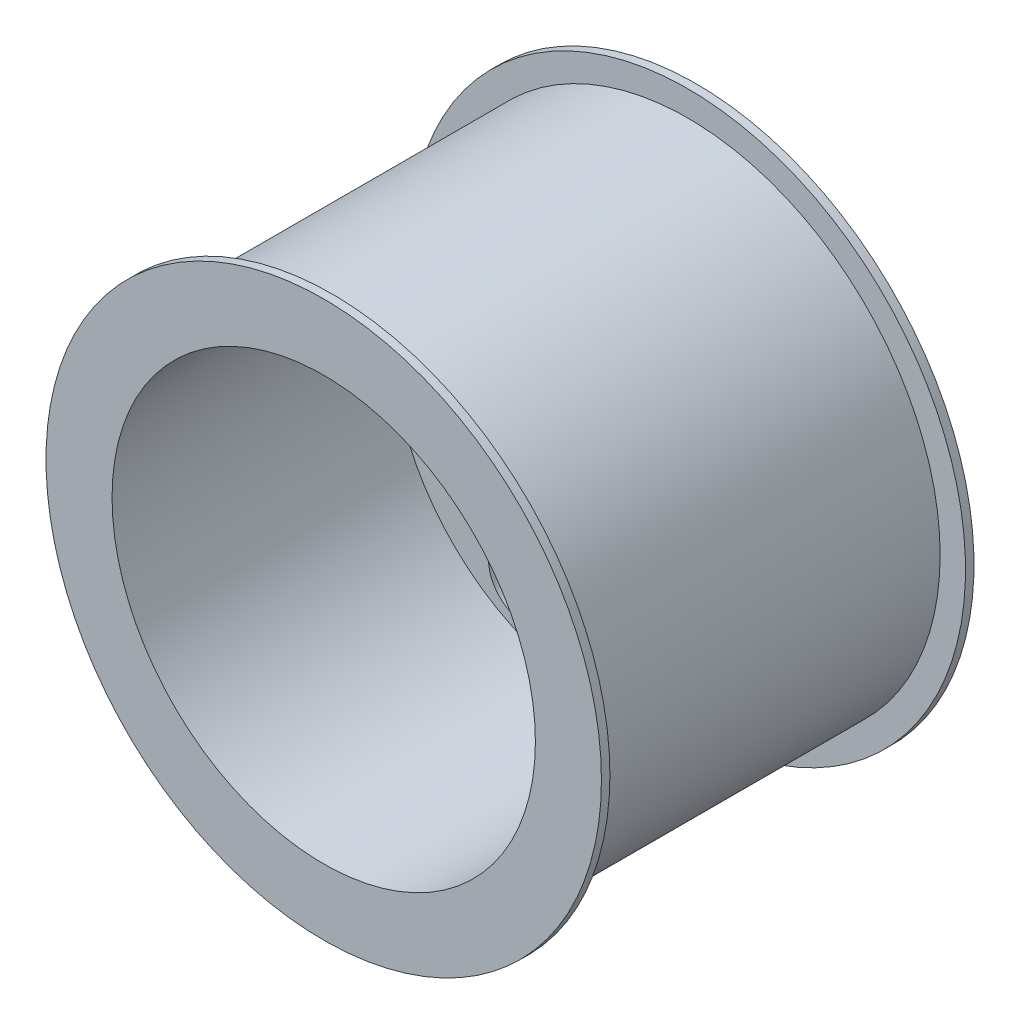
from build123d import *

# Parameters (mm, degrees)
SKETCH1_R           = 32.8
SKETCH1_R_2         = 25
BOSS_EXTRUDE1_DEPTH = 1
BOSS_EXTRUDE2_START = -33
SKETCH2_R           = 29.8
SKETCH2_R_2         = 25
BOSS_EXTRUDE2_DEPTH = 33
BOSS_EXTRUDE3_START = 10
SKETCH3_R           = 29.8
BOSS_EXTRUDE3_DEPTH = 10
BOSS_EXTRUDE4_START = 1
SKETCH4_R           = 32.8
BOSS_EXTRUDE4_DEPTH = 1
SKETCH5_R           = 2.95
CUT_EXTRUDE1_DEPTH  = 64.934966959
SKETCH6_R           = 4.45
CUT_EXTRUDE2_DEPTH  = 64.934966959
SKETCH7_R           = 3
CUT_EXTRUDE3_DEPTH  = 9.4
SKETCH8_R           = 2.5
CUT_EXTRUDE4_DEPTH  = 21


with BuildPart() as part:
    # Sketch1 → Boss-Extrude1 (new body)
    with BuildSketch(Plane.XY):
        Circle(SKETCH1_R)
        Circle(SKETCH1_R_2, mode=Mode.SUBTRACT)
    extrude(amount=BOSS_EXTRUDE1_DEPTH)

    # Sketch2 → Boss-Extrude2 (add)
    with BuildSketch(Plane.XY.offset(1).offset(BOSS_EXTRUDE2_START)):
        Circle(SKETCH2_R)
        Circle(SKETCH2_R_2, mode=Mode.SUBTRACT)
    extrude(amount=BOSS_EXTRUDE2_DEPTH)

    # Sketch3 → Boss-Extrude3 (add)
    with BuildSketch(Plane(origin=(0, 0, -32), x_dir=(-1, 0, 0), z_dir=(0, 0, -1)).offset(BOSS_EXTRUDE3_START)):
        with Locations(Location((0, 0, 0), (0, 0, 180))):
            Circle(SKETCH3_R)
    extrude(amount=-BOSS_EXTRUDE3_DEPTH)

    # Sketch4 → Boss-Extrude4 (add)
    with BuildSketch(Plane(origin=(0, 0, -42), x_dir=(-1, 0, 0), z_dir=(0, 0, -1)).offset(BOSS_EXTRUDE4_START)):
        with Locations(Location((0, 0, 0), (0, 0, 180))):
            Circle(SKETCH4_R)
    extrude(amount=-BOSS_EXTRUDE4_DEPTH)

    # Sketch5 → Cut-Extrude1 (cut, through all)
    with BuildSketch(Plane(origin=(0, 0, -43), x_dir=(-1, 0, 0), z_dir=(0, 0, -1))):
        Circle(SKETCH5_R)
    extrude(amount=-CUT_EXTRUDE1_DEPTH, mode=Mode.SUBTRACT)

    # Sketch6 → Cut-Extrude2 (cut, through all)
    with BuildSketch(Plane(origin=(0, 0, -43), x_dir=(-1, 0, 0), z_dir=(0, 0, -1))):
        with Locations((10.300490658, 16.439583091)):
            Circle(SKETCH6_R)
        with Locations((19.387341913, -0.700695036)):
            Circle(SKETCH6_R)
        with Locations((9.086851255, -17.140278127)):
            Circle(SKETCH6_R)
        with Locations((-10.300490658, -16.439583091)):
            Circle(SKETCH6_R)
        with Locations((-19.387341913, 0.700695036)):
            Circle(SKETCH6_R)
        with Locations((-9.086851255, 17.140278127)):
            Circle(SKETCH6_R)
    extrude(amount=-CUT_EXTRUDE2_DEPTH, mode=Mode.SUBTRACT)

    # Sketch7 → Cut-Extrude3 (cut)
    with BuildSketch(Plane(origin=(-25.807557033, 14.9, 0), x_dir=(0, 0, 1), z_dir=(-0.8660254037844398, 0.499999999999998, 0))):
        with Locations(Location((-37.1, -1.017819827, 0), (0, 0, 270))):
            Circle(SKETCH7_R)
    extrude(amount=-CUT_EXTRUDE3_DEPTH, mode=Mode.SUBTRACT)

    # Sketch8 → Cut-Extrude4 (cut)
    with BuildSketch(Plane(origin=(-17.666918237, 10.2, 0), x_dir=(0, 0, 1), z_dir=(-0.8660254037844398, 0.49999999999999806, 0))):
        with Locations(Location((-37.1, -1.017819827, 0), (0, 0, 270))):
            Circle(SKETCH8_R)
    extrude(amount=-CUT_EXTRUDE4_DEPTH, mode=Mode.SUBTRACT)


solid = part.part
